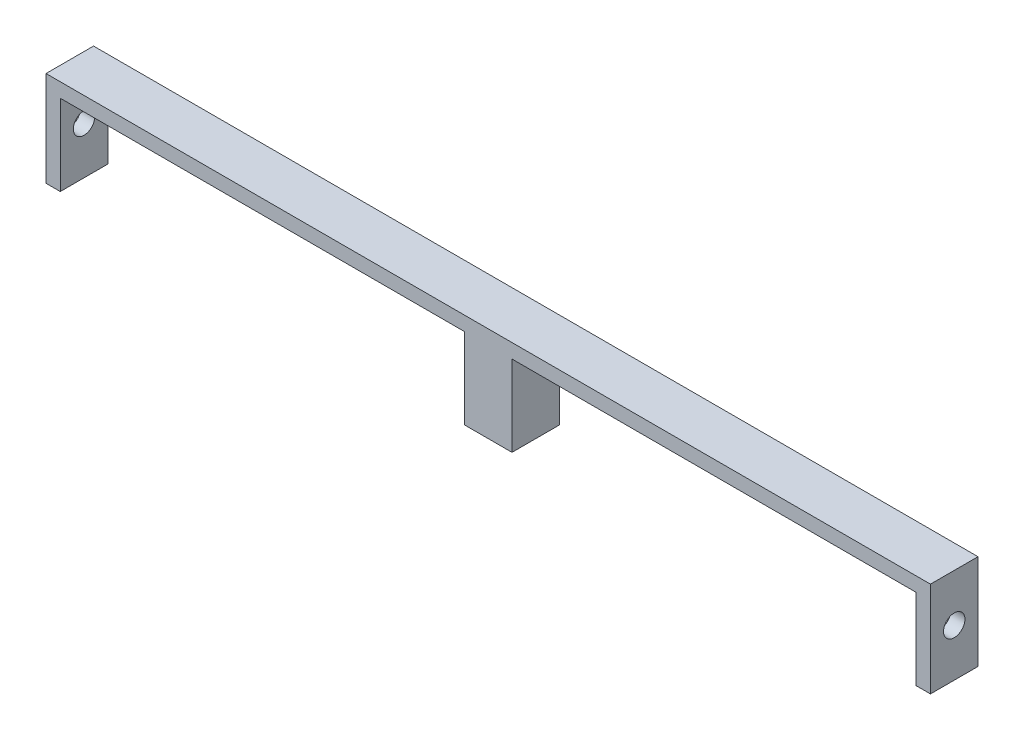
from build123d import *

# Parameters (mm, degrees)
DODANIE_WYCI_GNI_CIE1_DEPTH = 10
SZKIC4_R                    = 2.25
WYTNIJ_WYCI_GNI_CIE1_DEPTH  = 10
WYTNIJ_WYCI_GNI_CIE2_START  = -183
SZKIC4_2_R                  = 2.25
WYTNIJ_WYCI_GNI_CIE2_DEPTH  = 10


with BuildPart() as part:
    # Szkic2 → Dodanie-wyciągnięcie1 (new body)
    with BuildSketch(Plane.XY):
        Polygon((-60.434598082, 22.68907563), (125.565401918, 22.68907563), (125.565401918, 2.68907563), (122.565401918, 2.68907563), (122.565401918, 19.68907563), (37.565401918, 19.68907563), (37.565401918, 2.68907563), (27.565401918, 2.68907563), (27.565401918, 19.68907563), (-57.434598082, 19.68907563), (-57.434598082, 2.68907563), (-60.434598082, 2.68907563), align=None)
    extrude(amount=DODANIE_WYCI_GNI_CIE1_DEPTH)

    # Szkic4 → Wytnij-wyciągnięcie1 (cut)
    with BuildSketch(Plane.ZY.offset(60.434598082)):
        with Locations((5, 12.68907563)):
            Circle(SZKIC4_R)
    extrude(amount=-WYTNIJ_WYCI_GNI_CIE1_DEPTH, mode=Mode.SUBTRACT)

    # Szkic4<2> → Wytnij-wyciągnięcie2 (cut)
    with BuildSketch(Plane.ZY.offset(60.434598082).offset(WYTNIJ_WYCI_GNI_CIE2_START)):
        with Locations((5, 12.68907563)):
            Circle(SZKIC4_2_R)
    extrude(amount=-WYTNIJ_WYCI_GNI_CIE2_DEPTH, mode=Mode.SUBTRACT)


solid = part.part
